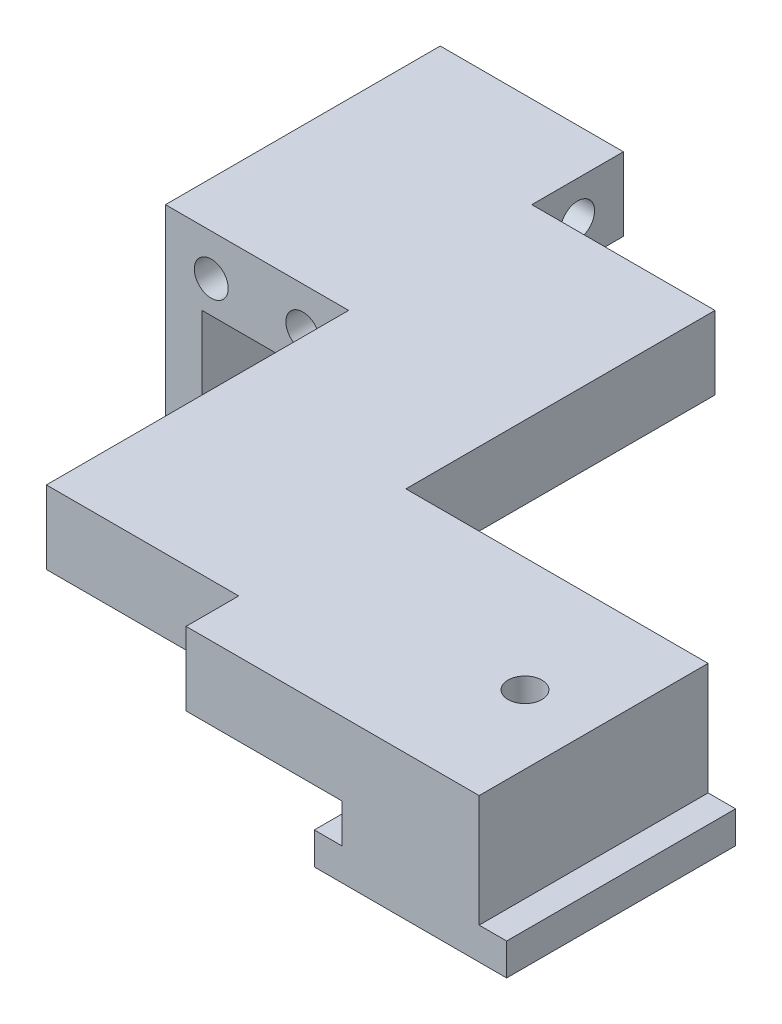
from build123d import *

# Parameters (mm, degrees)
BOSS_EXTRUDE1_DEPTH            = 12.5
SKETCH2_W                      = 25
SKETCH2_H                      = 8
BOSS_EXTRUDE2_DEPTH            = 38
SKETCH7_W                      = 20
SKETCH7_H                      = 8
BOSS_EXTRUDE3_DEPTH            = 33.75
SKETCH10_W                     = 20
SKETCH10_H                     = 8
BOSS_EXTRUDE4_DEPTH            = 20
SKETCH11_W                     = 20
SKETCH11_H                     = 8
BOSS_EXTRUDE5_DEPTH            = 10
F_3_7_3_7_DIAMETER_HOLE2_D     = 3.7
F_3_7_3_7_DIAMETER_HOLE2_DEPTH = 10
F_3_7_3_7_DIAMETER_HOLE2_TIP   = 1.111592145
F_3_7_3_7_DIAMETER_HOLE1_D     = 3.7
F_3_7_3_7_DIAMETER_HOLE3_D     = 3.7
SKETCH12_W                     = 21
SKETCH12_H                     = 5.75
CUT_EXTRUDE1_DEPTH             = 88.763175649
SKETCH14_W                     = 4
SKETCH14_H                     = 30
BOSS_EXTRUDE7_DEPTH            = 15.5
SKETCH15_W                     = 30
SKETCH15_H                     = 2.25
BOSS_EXTRUDE8_DEPTH            = 5


with BuildPart() as part:
    # Sketch1 → Boss-Extrude1 (new, symmetric)
    with BuildSketch(Plane.XY):
        Polygon((-10.5, 0), (10.5, 0), (10.5, 3.5), (7.5, 3.5), (7.5, 15.75), (-7.5, 15.75), (-7.5, 3.5), (-10.5, 3.5), align=None)
    extrude(amount=BOSS_EXTRUDE1_DEPTH, both=True)

    # Sketch2 → Boss-Extrude2 (add)
    with BuildSketch(Plane.ZY.offset(7.5)):
        with Locations((0, 11.75)):
            Rectangle(SKETCH2_W, SKETCH2_H)
    extrude(amount=BOSS_EXTRUDE2_DEPTH)

    # Sketch7 → Boss-Extrude3 (add)
    with BuildSketch(Plane(origin=(0, 0, -12.5), x_dir=(-1, 0, 0), z_dir=(0, 0, -1))):
        with Locations((35.5, 11.75)):
            Rectangle(SKETCH7_W, SKETCH7_H)
    extrude(amount=BOSS_EXTRUDE3_DEPTH)

    # Sketch10 → Boss-Extrude4 (add)
    with BuildSketch(Plane.ZY.offset(45.5)):
        with Locations((-36.25, 11.75)):
            Rectangle(SKETCH10_W, SKETCH10_H)
    extrude(amount=BOSS_EXTRUDE4_DEPTH)

    # Sketch11 → Boss-Extrude5 (add)
    with BuildSketch(Plane(origin=(0, 0, -46.25), x_dir=(-1, 0, 0), z_dir=(0, 0, -1))):
        with Locations((55.5, 11.75)):
            Rectangle(SKETCH11_W, SKETCH11_H)
    extrude(amount=BOSS_EXTRUDE5_DEPTH)

    # Ø3.7 (3.7) Diameter Hole2
    with Locations(Plane.XY.offset(-26.25)):
        with Locations((-60.5, 11.25), (-50.5, 11.25)):
            Hole(F_3_7_3_7_DIAMETER_HOLE2_D / 2, depth=F_3_7_3_7_DIAMETER_HOLE2_DEPTH)
            with Locations((0, 0, -(F_3_7_3_7_DIAMETER_HOLE2_DEPTH + F_3_7_3_7_DIAMETER_HOLE2_TIP / 2))):  # 118° drill point
                Cone(0, F_3_7_3_7_DIAMETER_HOLE2_D / 2, F_3_7_3_7_DIAMETER_HOLE2_TIP, mode=Mode.SUBTRACT)

    # Ø3.7 (3.7) Diameter Hole1 (through all)
    with Locations(Plane.ZY.offset(65.5)):
        with Locations((-51.25, 11.75)):
            Hole(F_3_7_3_7_DIAMETER_HOLE1_D / 2)

    # Ø3.7 (3.7) Diameter Hole3 (through all)
    with Locations(Plane(origin=(0, 15.75, 0), x_dir=(1, 0, 0), z_dir=(0, 1, 0))):
        with Locations((0, 0)):
            Hole(F_3_7_3_7_DIAMETER_HOLE3_D / 2)

    # Sketch12 → Cut-Extrude1 (cut, through all)
    with BuildSketch(Plane(origin=(0, 15.75, 0), x_dir=(1, 0, 0), z_dir=(0, 1, 0))):
        with Locations((-35, -9.625)):
            Rectangle(SKETCH12_W, SKETCH12_H)
    extrude(amount=-CUT_EXTRUDE1_DEPTH, mode=Mode.SUBTRACT)

    # Sketch14 → Boss-Extrude7 (add)
    with BuildSketch(Plane.XZ.offset(-7.75)):
        with Locations((-63.5, -41.25)):
            Rectangle(SKETCH14_W, SKETCH14_H)
    extrude(amount=BOSS_EXTRUDE7_DEPTH)

    # Sketch15 → Boss-Extrude8 (add)
    with BuildSketch(Plane(origin=(-61.5, 0, 0), x_dir=(0, 0, -1), z_dir=(1, 0, 0))):
        with Locations((41.25, -6.625)):
            Rectangle(SKETCH15_W, SKETCH15_H)
    extrude(amount=BOSS_EXTRUDE8_DEPTH)


solid = part.part
